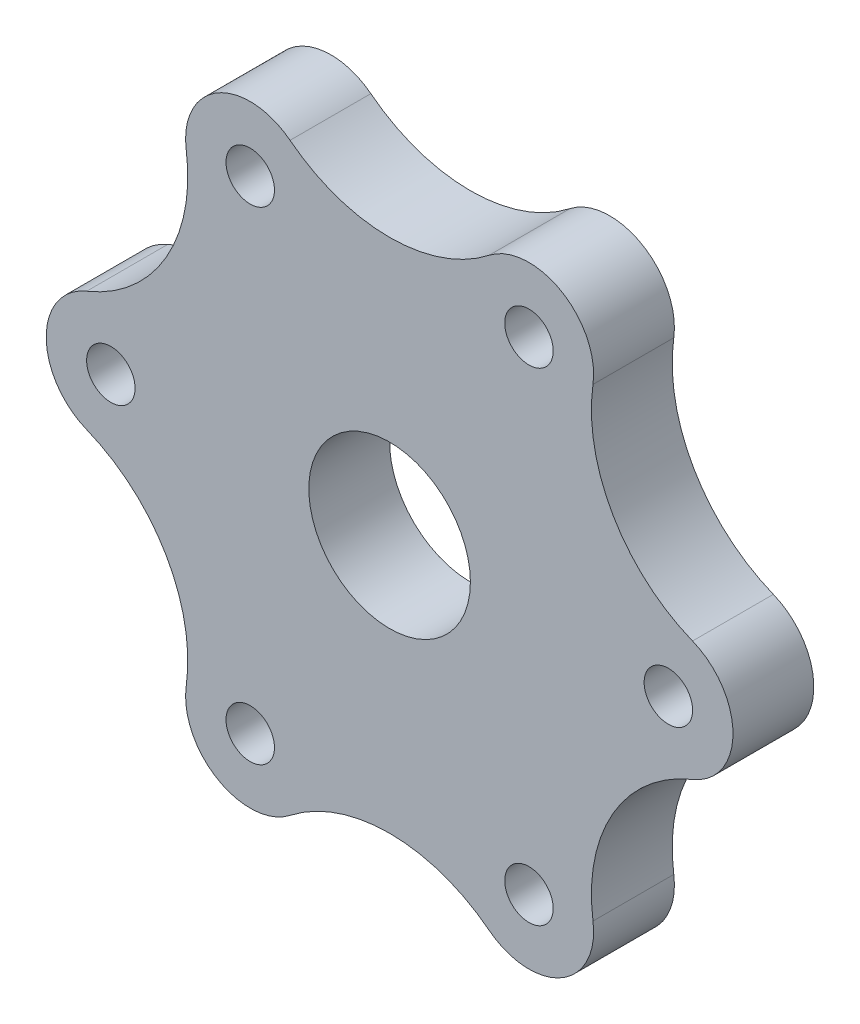
from build123d import *

# Parameters (mm, degrees)
SKETCH1_R           = 10
SKETCH1_R_2         = 3
BOSS_EXTRUDE1_DEPTH = 5


with BuildPart() as part:
    # Sketch1 → Boss-Extrude1 (new, symmetric)
    with BuildSketch(Plane.XY):
        with BuildLine():
            ThreePointArc((37.492992706, -7.419029226), (42.5, 0), (37.492992706, 7.419029226))
            ThreePointArc((37.492992706, 7.419029226), (27.654966395, 15.966602293), (25.171564134, 28.760369534))
            ThreePointArc((25.171564134, 28.760369534), (21.25, 36.806079661), (12.321428571, 36.17939876))
            ThreePointArc((12.321428571, 36.17939876), (0, 31.933204585), (-12.321428571, 36.17939876))
            ThreePointArc((-12.321428571, 36.17939876), (-21.25, 36.806079661), (-25.171564134, 28.760369534))
            ThreePointArc((-25.171564134, 28.760369534), (-27.654966395, 15.966602293), (-37.492992706, 7.419029226))
            ThreePointArc((-37.492992706, 7.419029226), (-42.5, 0), (-37.492992706, -7.419029226))
            ThreePointArc((-37.492992706, -7.419029226), (-27.654966395, -15.966602293), (-25.171564134, -28.760369534))
            ThreePointArc((-25.171564134, -28.760369534), (-21.25, -36.806079661), (-12.321428571, -36.17939876))
            ThreePointArc((-12.321428571, -36.17939876), (0, -31.933204585), (12.321428571, -36.17939876))
            ThreePointArc((12.321428571, -36.17939876), (21.25, -36.806079661), (25.171564134, -28.760369534))
            ThreePointArc((25.171564134, -28.760369534), (27.654966395, -15.966602293), (37.492992706, -7.419029226))
        make_face()
        Circle(SKETCH1_R, mode=Mode.SUBTRACT)
        with Locations((34.5, 0)):
            Circle(SKETCH1_R_2, mode=Mode.SUBTRACT)
        with Locations((17.25, -29.877876431)):
            Circle(SKETCH1_R_2, mode=Mode.SUBTRACT)
        with Locations((-17.25, -29.877876431)):
            Circle(SKETCH1_R_2, mode=Mode.SUBTRACT)
        with Locations((-34.5, 0)):
            Circle(SKETCH1_R_2, mode=Mode.SUBTRACT)
        with Locations((-17.25, 29.877876431)):
            Circle(SKETCH1_R_2, mode=Mode.SUBTRACT)
        with Locations((17.25, 29.877876431)):
            Circle(SKETCH1_R_2, mode=Mode.SUBTRACT)
    extrude(amount=BOSS_EXTRUDE1_DEPTH, both=True)


solid = part.part
